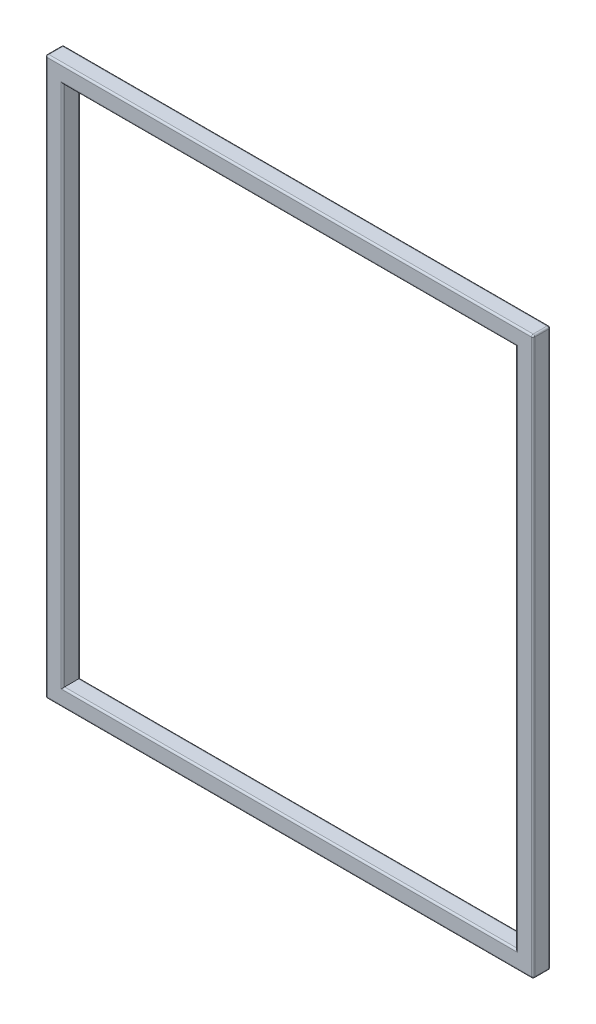
from build123d import *

# Parameters (mm, degrees)
SKETCH1_W           = 711.2
SKETCH1_H           = 812.8
SKETCH1_W_2         = 660.4
SKETCH1_H_2         = 762
BOSS_EXTRUDE1_DEPTH = 25.4
FILLET1_R           = 2.54


with BuildPart() as part:
    # Sketch1 → Boss-Extrude1 (new body)
    with BuildSketch(Plane.XY):
        with Locations((-355.6, 406.4)):
            Rectangle(SKETCH1_W, SKETCH1_H)
        with Locations((-355.6, 406.4)):
            Rectangle(SKETCH1_W_2, SKETCH1_H_2, mode=Mode.SUBTRACT)
    extrude(amount=BOSS_EXTRUDE1_DEPTH)

    # Fillet1
    fillet1_edges = [part.edges().sort_by_distance(p)[0] for p in [
        (-711.2, 406.4, 25.4),
        (-25.4, 406.4, 0),
        (-355.6, 787.4, 0),
        (-685.8, 406.4, 0),
        (-355.6, 25.4, 0),
        (-25.4, 406.4, 25.4),
        (-355.6, 0, 25.4),
        (-355.6, 787.4, 25.4),
        (-685.8, 406.4, 25.4),
        (-355.6, 25.4, 25.4),
        (0, 406.4, 25.4),
        (-355.6, 0, 0),
        (-711.2, 406.4, 0),
        (-355.6, 812.8, 0),
        (0, 406.4, 0),
        (0, 0, 12.7),
        (-711.2, 0, 12.7),
        (-711.2, 812.8, 12.7),
        (0, 812.8, 12.7),
        (-355.6, 812.8, 25.4),
    ]]
    fillet(fillet1_edges, radius=FILLET1_R)


solid = part.part
